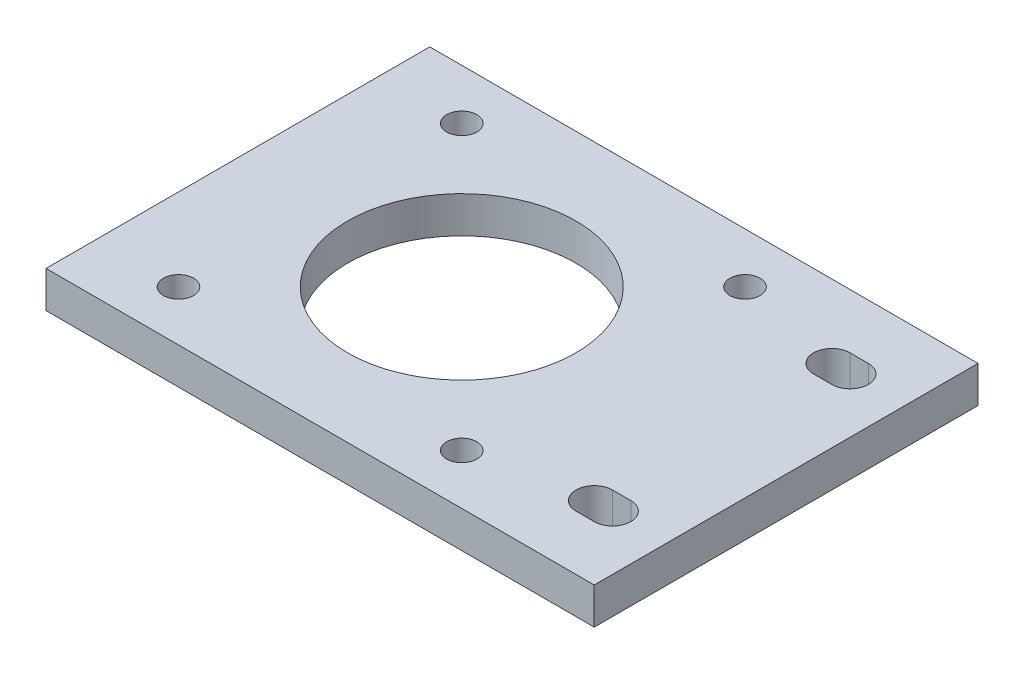
from build123d import *

# Parameters (mm, degrees)
SKETCH_1_W      = 60
SKETCH_1_H      = 42
SKETCH_1_R      = 1.65
SKETCH_1_R_2    = 12.5
EXTRUDE_1_DEPTH = 4


with BuildPart() as part:
    # 草图1 → 凸台-拉伸1 (new body)
    with BuildSketch(Plane(origin=(0, 0, 0), x_dir=(1, 0, 0), z_dir=(0, 1, 0))):
        with Locations((23.247873649, -17.102984292)):
            Rectangle(SKETCH_1_W, SKETCH_1_H)
        with Locations(Location((2.247873649, -1.602984292, 0), (0, 0, 270))):
            Circle(SKETCH_1_R, mode=Mode.SUBTRACT)
        with Locations(Location((33.247873649, -1.602984292, 0), (0, 0, 270))):
            Circle(SKETCH_1_R, mode=Mode.SUBTRACT)
        with Locations(Location((33.247873649, -32.602984292, 0), (0, 0, 270))):
            Circle(SKETCH_1_R, mode=Mode.SUBTRACT)
        with Locations(Location((2.247873649, -32.602984292, 0), (0, 0, 270))):
            Circle(SKETCH_1_R, mode=Mode.SUBTRACT)
        with Locations(Location((17.747873649, -17.102984292, 0), (0, 0, 270))):
            Circle(SKETCH_1_R_2, mode=Mode.SUBTRACT)
        with BuildLine():
            Line((45.247873649, -2.102984292), (47.247873649, -2.102984292))
            ThreePointArc((47.247873649, -2.102984292), (49.247873649, -4.102984292), (47.247873649, -6.102984292))
            Line((47.247873649, -6.102984292), (45.247873649, -6.102984292))
            ThreePointArc((45.247873649, -6.102984292), (43.247873649, -4.102984292), (45.247873649, -2.102984292))
        make_face(mode=Mode.SUBTRACT)
        with BuildLine():
            Line((45.247873649, -32.102984292), (47.247873649, -32.102984292))
            ThreePointArc((47.247873649, -32.102984292), (49.247873649, -30.102984292), (47.247873649, -28.102984292))
            Line((47.247873649, -28.102984292), (45.247873649, -28.102984292))
            ThreePointArc((45.247873649, -28.102984292), (43.247873649, -30.102984292), (45.247873649, -32.102984292))
        make_face(mode=Mode.SUBTRACT)
    extrude(amount=EXTRUDE_1_DEPTH)


solid = part.part
